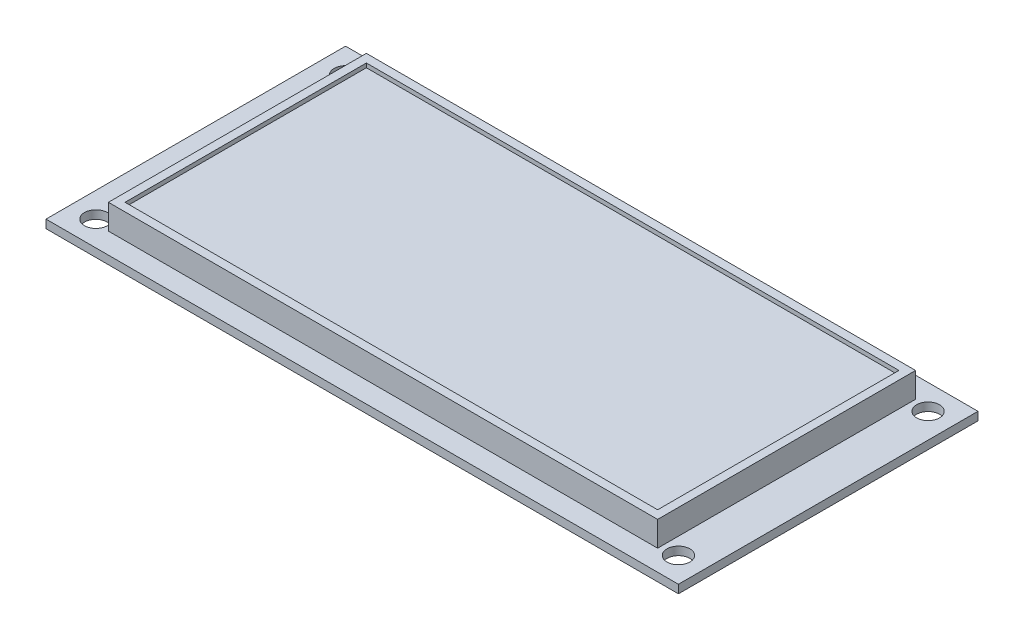
from build123d import *

# Parameters (mm, degrees)
SKETCH1_W           = 76
SKETCH1_H           = 36
BOSS_EXTRUDE1_DEPTH = 1
SKETCH2_W           = 66
SKETCH2_H           = 31
BOSS_EXTRUDE2_DEPTH = 3
SKETCH3_W           = 64
SKETCH3_H           = 29
CUT_EXTRUDE1_DEPTH  = 0.5
SKETCH4_R           = 1.375
CUT_EXTRUDE2_DEPTH  = 5


with BuildPart() as part:
    # Sketch1 → Boss-Extrude1 (new body)
    with BuildSketch(Plane(origin=(0, 0, 0), x_dir=(1, 0, 0), z_dir=(0, 1, 0))):
        Rectangle(SKETCH1_W, SKETCH1_H)
    extrude(amount=BOSS_EXTRUDE1_DEPTH)

    # Sketch2 → Boss-Extrude2 (add)
    with BuildSketch(Plane(origin=(0, 1, 0), x_dir=(1, 0, 0), z_dir=(0, 1, 0))):
        Rectangle(SKETCH2_W, SKETCH2_H)
    extrude(amount=BOSS_EXTRUDE2_DEPTH)

    # Sketch3 → Cut-Extrude1 (cut)
    with BuildSketch(Plane(origin=(0, 4, 0), x_dir=(1, 0, 0), z_dir=(0, 1, 0))):
        Rectangle(SKETCH3_W, SKETCH3_H)
    extrude(amount=-CUT_EXTRUDE1_DEPTH, mode=Mode.SUBTRACT)

    # Sketch4 → Cut-Extrude2 (cut)
    with BuildSketch(Plane(origin=(0, 1, 0), x_dir=(1, 0, 0), z_dir=(0, 1, 0))):
        with Locations(Location((-35, 15, 0), (0, 0, 270))):
            Circle(SKETCH4_R)
        with Locations(Location((-35, -15, 0), (0, 0, 270))):
            Circle(SKETCH4_R)
        with Locations(Location((35, -15, 0), (0, 0, 270))):
            Circle(SKETCH4_R)
        with Locations(Location((35, 15, 0), (0, 0, 270))):
            Circle(SKETCH4_R)
    extrude(amount=-CUT_EXTRUDE2_DEPTH, mode=Mode.SUBTRACT)


solid = part.part
